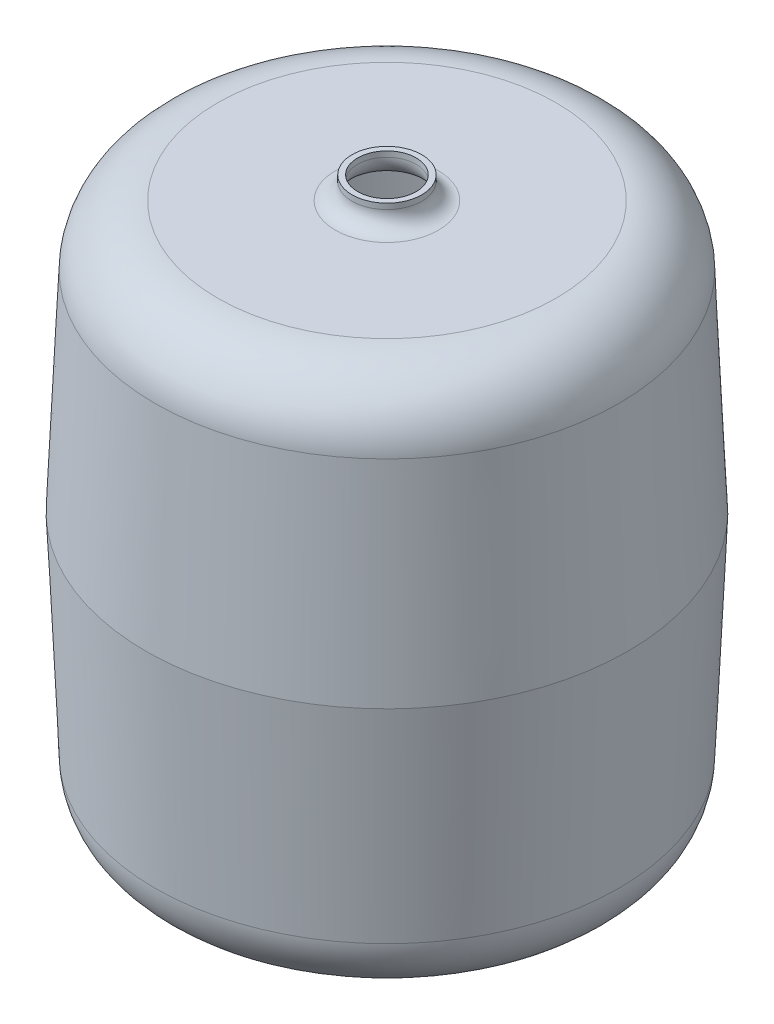
from build123d import *


with BuildPart() as part:
    # Sketch1 → Revolve4 (revolve)
    with BuildSketch(Plane.XY):
        with BuildLine():
            Line((0, -193.75), (121.539022915, -193.75))
            ThreePointArc((121.539022915, -193.75), (152.657110425, -181.256378293), (166.496192886, -150.712872431))
            Line((166.496192886, -150.712872431), (173.076459005, 0))
            Line((173.076459005, 0), (166.496192886, 150.712872431))
            ThreePointArc((166.496192886, 150.712872431), (152.657110425, 181.256378293), (121.539022915, 193.75))
            Line((121.539022915, 193.75), (37, 193.75))
            ThreePointArc((37, 193.75), (28.514718626, 197.264718626), (25, 205.75))
            Line((25, 205.75), (25, 209.75))
            Line((25, 209.75), (21, 209.75))
            Line((21, 209.75), (21, 205.75))
            ThreePointArc((21, 205.75), (25.686291501, 194.436291501), (37, 189.75))
            Line((37, 189.75), (121.539022915, 189.75))
            ThreePointArc((121.539022915, 189.75), (149.891058202, 178.366922444), (162.5, 150.538394882))
            Line((162.5, 150.538394882), (169.072648264, 0))
            Line((169.072648264, 0), (162.5, -150.538394882))
            ThreePointArc((162.5, -150.538394882), (149.891058202, -178.366922444), (121.539022915, -189.75))
            Line((121.539022915, -189.75), (0, -189.75))
            Line((0, -189.75), (0, -193.75))
        make_face()
    revolve(axis=Axis((0, -193.75, 0), (0, 1, 0)))


solid = part.part
